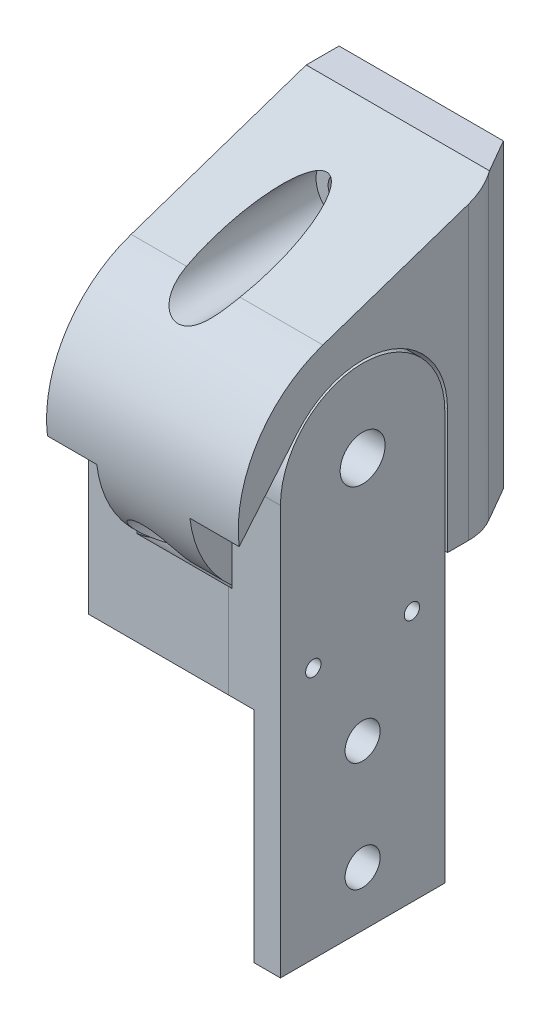
from build123d import *

# Parameters (mm, degrees)
SKETCH1_R               = 7.7
BOSS_EXTRUDE1_DEPTH     = 8.5
BOSS_EXTRUDE2_DEPTH     = 17.5
BOSS_EXTRUDE3_START     = 8.7
SKETCH1_5_R             = 7.7
SKETCH1_5_R_2           = 4.1
BOSS_EXTRUDE3_DEPTH     = 8.8
BOSS_EXTRUDE5_START     = 12.7
SKETCH1_8_W             = 40
SKETCH1_8_H             = 30
SKETCH1_8_R             = 3.2
BOSS_EXTRUDE5_DEPTH     = 4.8
BOSS_EXTRUDE6_START     = -17.5
BOSS_EXTRUDE6_DEPTH     = 30.2
BOSS_EXTRUDE7_START     = -17.5
SKETCH1_11_R            = 7.7
SKETCH1_11_R_2          = 4.1
BOSS_EXTRUDE7_DEPTH     = 8.8
SKETCH2_R               = 1.7
SKETCH2_R_2             = 1.4
CUT_EXTRUDE1_DEPTH      = 89.020338559
SKETCH2_4_R             = 3
SKETCH2_4_R_2           = 1.7
CUT_EXTRUDE2_DEPTH      = 4
SKETCH2_5_R             = 1.4
CUT_EXTRUDE3_DEPTH      = 89.020338559
SKETCH3_R               = 3.2
CUT_EXTRUDE4_DEPTH      = 76.747871257
CUT_EXTRUDE5_START      = -5
SKETCH3_3_R             = 6
SKETCH3_3_R_2           = 3.2
CUT_EXTRUDE5_DEPTH      = 71.747871257
CUT_EXTRUDE6_DEPTH      = 113.684249121
CUT_EXTRUDE7_DEPTH      = 94.476735073
CUT_EXTRUDE8_DEPTH      = 1
CUT_EXTRUDE8_DEPTH_BACK = 79.476735149
CUT_EXTRUDE8_START      = -15
CUT_EXTRUDE12_START     = -33
CUT_EXTRUDE12_DEPTH     = 61.476735149


with BuildPart() as part:
    # Sketch1 → Boss-Extrude1 (new, symmetric)
    with BuildSketch(Plane.YZ):
        with BuildLine():
            Line((-22.7, -15.5), (0, -15.5))
            ThreePointArc((0, -15.5), (14.565235622, -5.301312222), (9.96320795, 11.873688868))
            Line((9.96320795, 11.873688868), (-2.741125853, 22.533890677))
            ThreePointArc((-2.741125853, 22.533890677), (-16.992844919, 15.051020615), (-22.7, 0))
            Line((-22.7, 0), (-22.7, -15.5))
        make_face()
        with Locations(Location((0, 0, 0), (0, 0, 270))):
            Circle(SKETCH1_R, mode=Mode.SUBTRACT)
    extrude(amount=BOSS_EXTRUDE1_DEPTH, both=True)

    # Sketch1<3> → Boss-Extrude2 (add, symmetric)
    with BuildSketch(Plane.YZ):
        with BuildLine():
            Line((-16.584329953, -15.5), (-22.7, -15.5))
            Line((-22.7, -15.5), (-22.7, -30.7))
            Line((-22.7, -30.7), (32.3, -30.7))
            Line((32.3, -30.7), (32.3, -24.7))
            Line((32.3, -24.7), (21.506897801, 7.262461497))
            ThreePointArc((21.506897801, 7.262461497), (22.399738615, 3.679906244), (22.7, 0))
            ThreePointArc((22.7, 0), (8.331437753, -21.115803204), (-16.584329953, -15.5))
        make_face()
        with BuildLine():
            Line((0, -15.5), (-16.584329953, -15.5))
            ThreePointArc((-16.584329953, -15.5), (8.331437753, -21.115803204), (22.7, 0))
            ThreePointArc((22.7, 0), (22.399738615, 3.679906244), (21.506897801, 7.262461497))
            ThreePointArc((21.506897801, 7.262461497), (12.097218131, 19.208001289), (-2.741125853, 22.533890677))
            Line((-2.741125853, 22.533890677), (9.96320795, 11.873688868))
            ThreePointArc((9.96320795, 11.873688868), (14.565235622, -5.301312222), (0, -15.5))
        make_face()
    extrude(amount=BOSS_EXTRUDE2_DEPTH, both=True)

    # Sketch6 → Cut-Extrude6 (cut, through all)
    with BuildSketch(Plane(origin=(0, 32.3, 0), x_dir=(-1, 0, 0), z_dir=(0, 1, 0))):
        Polygon((-15.964101615, -24.7), (-17.5, -24.7), (-17.5, -30.7), (-12.5, -30.7), align=None)
        with BuildLine():
            ThreePointArc((-16.160254038, -24.360254038), (-17.159258263, -21.948444489), (-17.5, -19.360254038))
            Line((-17.5, -19.360254038), (-17.5, -24.7))
            Line((-17.5, -24.7), (-15.964101615, -24.7))
            Line((-15.964101615, -24.7), (-16.160254038, -24.360254038))
        make_face()
    extrude(amount=-CUT_EXTRUDE6_DEPTH, mode=Mode.SUBTRACT)

    # Sketch7 → Cut-Extrude7 (cut, through all)
    with BuildSketch(Plane(origin=(0, 0, -30.7), x_dir=(1, 0, 0), z_dir=(0, 0, -1))):
        with BuildLine():
            ThreePointArc((-2.5, 18.7), (-5.5, 15.7), (-2.5, 12.7))
            Line((-2.5, 12.7), (-2.5, 18.7))
        make_face()
        with BuildLine():
            Line((-2.5, 18.7), (-2.5, 12.7))
            ThreePointArc((-2.5, 12.7), (-0.378679656, 13.578679656), (0.5, 15.7))
            ThreePointArc((0.5, 15.7), (-0.378679656, 17.821320344), (-2.5, 18.7))
        make_face()
        with BuildLine():
            ThreePointArc((0.5, -23.3), (-0.378679656, -21.178679656), (-2.5, -20.3))
            Line((-2.5, -20.3), (-2.5, -26.3))
            ThreePointArc((-2.5, -26.3), (-0.378679656, -25.421320344), (0.5, -23.3))
        make_face()
        with BuildLine():
            Line((-2.5, -26.3), (-2.5, -20.3))
            ThreePointArc((-2.5, -20.3), (-5.5, -23.3), (-2.5, -26.3))
        make_face()
    extrude(amount=-CUT_EXTRUDE7_DEPTH, mode=Mode.SUBTRACT)

    # Sketch7<3> → Cut-Extrude8 (cut, two sides: drawn at the far end of the back side and taken through both)
    with BuildSketch(Plane(origin=(0, 0, -30.7), x_dir=(1, 0, 0), z_dir=(0, 0, -1)).offset(CUT_EXTRUDE8_START - CUT_EXTRUDE8_DEPTH_BACK)):
        with BuildLine():
            ThreePointArc((2.7, -23.3), (1.176955262, -19.623044738), (-2.5, -18.1))
            Line((-2.5, -18.1), (-2.5, -20.3))
            ThreePointArc((-2.5, -20.3), (-0.378679656, -21.178679656), (0.5, -23.3))
            ThreePointArc((0.5, -23.3), (-0.378679656, -25.421320344), (-2.5, -26.3))
            Line((-2.5, -26.3), (-2.5, -28.5))
            ThreePointArc((-2.5, -28.5), (1.176955262, -26.976955262), (2.7, -23.3))
        make_face()
        with BuildLine():
            Line((-2.5, -20.3), (-2.5, -18.1))
            ThreePointArc((-2.5, -18.1), (-7.7, -23.3), (-2.5, -28.5))
            Line((-2.5, -28.5), (-2.5, -26.3))
            ThreePointArc((-2.5, -26.3), (-5.5, -23.3), (-2.5, -20.3))
        make_face()
    extrude(amount=CUT_EXTRUDE8_DEPTH + CUT_EXTRUDE8_DEPTH_BACK, mode=Mode.SUBTRACT)

    # Sketch7<5> → Cut-Extrude12 (cut, through all)
    with BuildSketch(Plane(origin=(0, 0, -30.7), x_dir=(1, 0, 0), z_dir=(0, 0, -1)).offset(CUT_EXTRUDE12_START)):
        with BuildLine():
            ThreePointArc((-2.5, 20.9), (-7.7, 15.7), (-2.5, 10.5))
            Line((-2.5, 10.5), (-2.5, 12.7))
            ThreePointArc((-2.5, 12.7), (-5.5, 15.7), (-2.5, 18.7))
            Line((-2.5, 18.7), (-2.5, 20.9))
        make_face()
        with BuildLine():
            Line((-2.5, 12.7), (-2.5, 10.5))
            ThreePointArc((-2.5, 10.5), (1.176955262, 12.023044738), (2.7, 15.7))
            ThreePointArc((2.7, 15.7), (1.176955262, 19.376955262), (-2.5, 20.9))
            Line((-2.5, 20.9), (-2.5, 18.7))
            ThreePointArc((-2.5, 18.7), (-0.378679656, 17.821320344), (0.5, 15.7))
            ThreePointArc((0.5, 15.7), (-0.378679656, 13.578679656), (-2.5, 12.7))
        make_face()
    extrude(amount=-CUT_EXTRUDE12_DEPTH, mode=Mode.SUBTRACT)


with BuildPart() as body_2:
    # Sketch1<5> → Boss-Extrude3 (new body)
    # profile 1 of 6: a face of its own
    with BuildSketch(Plane.YZ.offset(BOSS_EXTRUDE3_START)):
        with BuildLine():
            ThreePointArc((-22.7, 0), (-21.237352775, -8.016535856), (-17.037898931, -15))
            Line((-17.037898932, -15), (0, -15))
            ThreePointArc((0, -15), (15, 0), (0, 15))
            Line((0, 15), (-17.037898932, 15))
            ThreePointArc((-17.037898932, 15), (-21.237352775, 8.016535856), (-22.7, 0))
        make_face()
        with Locations(Location((0, 0, 0), (0, 0, 270))):
            Circle(SKETCH1_5_R, mode=Mode.SUBTRACT)
    # profile 2 of 6: a face of its own
    with BuildSketch(Plane.YZ.offset(BOSS_EXTRUDE3_START)):
        with BuildLine():
            ThreePointArc((-23.077649337, 0), (-22.983043085, -2.08749359), (-22.7, -4.157871923))
            Line((-22.7, -4.157871923), (-22.7, 0))
            ThreePointArc((-22.7, 0), (-21.237352775, 8.016535856), (-17.037898932, 15))
            Line((-17.037898932, 15), (-17.537898931, 15))
            ThreePointArc((-17.537898931, 15), (-21.648456996, 7.995136562), (-23.077649337, 0))
        make_face()
    # profile 3 of 6: a face of its own
    with BuildSketch(Plane.YZ.offset(BOSS_EXTRUDE3_START)):
        with BuildLine():
            Line((-22.7, -4.157871923), (-22.7, -15))
            Line((-22.7, -15), (-17.537898931, -15))
            ThreePointArc((-17.537898931, -15), (-20.836507935, -9.920576395), (-22.7, -4.157871923))
        make_face()
    # profile 4 of 6: a face of its own
    with BuildSketch(Plane.YZ.offset(BOSS_EXTRUDE3_START)):
        with BuildLine():
            Line((-22.7, 0), (-22.7, -4.157871923))
            ThreePointArc((-22.7, -4.157871923), (-20.836507935, -9.920576395), (-17.537898931, -15))
            Line((-17.537898931, -15), (-17.037898932, -15))
            ThreePointArc((-17.037898931, -15), (-21.237352775, -8.016535856), (-22.7, 0))
        make_face()
    # profile 5 of 6: a face of its own
    with BuildSketch(Plane.YZ.offset(BOSS_EXTRUDE3_START)):
        with BuildLine():
            Line((-23.077649337, -15), (-22.7, -15))
            Line((-22.7, -15), (-22.7, -4.157871923))
            ThreePointArc((-22.7, -4.157871923), (-22.983043085, -2.08749359), (-23.077649337, 0))
            Line((-23.077649337, 0), (-23.077649337, -15))
        make_face()
    # profile 6 of 6: a face of its own
    with BuildSketch(Plane.YZ.offset(BOSS_EXTRUDE3_START)):
        with Locations(Location((0, 0, 0), (0, 0, 270))):
            Circle(SKETCH1_5_R)
        with Locations(Location((0, 0, 0), (0, 0, 270))):
            Circle(SKETCH1_5_R_2, mode=Mode.SUBTRACT)
    extrude(amount=BOSS_EXTRUDE3_DEPTH)

    # Sketch1<8> → Boss-Extrude5 (add)
    # profile 1 of 2: a face of its own
    with BuildSketch(Plane.YZ.offset(BOSS_EXTRUDE5_START)):
        with Locations((-54.7, 0)):
            Rectangle(SKETCH1_8_W, SKETCH1_8_H)
        with Locations(Location((-64.7, 0, 0), (0, 0, 90))):
            Circle(SKETCH1_8_R, mode=Mode.SUBTRACT)
        with Locations(Location((-44.7, 0, 0), (0, 0, 90))):
            Circle(SKETCH1_8_R, mode=Mode.SUBTRACT)
    # profile 2 of 2: a face of its own
    with BuildSketch(Plane.YZ.offset(BOSS_EXTRUDE5_START)):
        with BuildLine():
            Line((-34.7, -15), (-23.077649337, -15))
            Line((-23.077649337, -15), (-23.077649337, 0))
            ThreePointArc((-23.077649337, 0), (-21.648456996, 7.995136562), (-17.537898931, 15))
            Line((-17.537898931, 15), (-34.7, 15))
            Line((-34.7, 15), (-34.7, -15))
        make_face()
    extrude(amount=BOSS_EXTRUDE5_DEPTH)

    # Sketch1<9> → Boss-Extrude6 (add)
    with BuildSketch(Plane.YZ.offset(BOSS_EXTRUDE6_START)):
        with BuildLine():
            Line((-34.7, -15), (-23.077649337, -15))
            Line((-23.077649337, -15), (-23.077649337, 0))
            ThreePointArc((-23.077649337, 0), (-21.648456996, 7.995136562), (-17.537898931, 15))
            Line((-17.537898931, 15), (-34.7, 15))
            Line((-34.7, 15), (-34.7, -15))
        make_face()
    extrude(amount=BOSS_EXTRUDE6_DEPTH)

    # Sketch1<11> → Boss-Extrude7 (add)
    # profile 1 of 6: a face of its own
    with BuildSketch(Plane.YZ.offset(BOSS_EXTRUDE7_START)):
        with BuildLine():
            ThreePointArc((-22.7, 0), (-21.237352775, -8.016535856), (-17.037898931, -15))
            Line((-17.037898932, -15), (0, -15))
            ThreePointArc((0, -15), (15, 0), (0, 15))
            Line((0, 15), (-17.037898932, 15))
            ThreePointArc((-17.037898932, 15), (-21.237352775, 8.016535856), (-22.7, 0))
        make_face()
        with Locations(Location((0, 0, 0), (0, 0, 270))):
            Circle(SKETCH1_11_R, mode=Mode.SUBTRACT)
    # profile 2 of 6: a face of its own
    with BuildSketch(Plane.YZ.offset(BOSS_EXTRUDE7_START)):
        with BuildLine():
            Line((-22.7, -4.157871923), (-22.7, -15))
            Line((-22.7, -15), (-17.537898931, -15))
            ThreePointArc((-17.537898931, -15), (-20.836507935, -9.920576395), (-22.7, -4.157871923))
        make_face()
    # profile 3 of 6: a face of its own
    with BuildSketch(Plane.YZ.offset(BOSS_EXTRUDE7_START)):
        with BuildLine():
            Line((-22.7, 0), (-22.7, -4.157871923))
            ThreePointArc((-22.7, -4.157871923), (-20.836507935, -9.920576395), (-17.537898931, -15))
            Line((-17.537898931, -15), (-17.037898932, -15))
            ThreePointArc((-17.037898931, -15), (-21.237352775, -8.016535856), (-22.7, 0))
        make_face()
    # profile 4 of 6: a face of its own
    with BuildSketch(Plane.YZ.offset(BOSS_EXTRUDE7_START)):
        with BuildLine():
            Line((-23.077649337, -15), (-22.7, -15))
            Line((-22.7, -15), (-22.7, -4.157871923))
            ThreePointArc((-22.7, -4.157871923), (-22.983043085, -2.08749359), (-23.077649337, 0))
            Line((-23.077649337, 0), (-23.077649337, -15))
        make_face()
    # profile 5 of 6: a face of its own
    with BuildSketch(Plane.YZ.offset(BOSS_EXTRUDE7_START)):
        with BuildLine():
            ThreePointArc((-23.077649337, 0), (-22.983043085, -2.08749359), (-22.7, -4.157871923))
            Line((-22.7, -4.157871923), (-22.7, 0))
            ThreePointArc((-22.7, 0), (-21.237352775, 8.016535856), (-17.037898932, 15))
            Line((-17.037898932, 15), (-17.537898931, 15))
            ThreePointArc((-17.537898931, 15), (-21.648456996, 7.995136562), (-23.077649337, 0))
        make_face()
    # profile 6 of 6: a face of its own
    with BuildSketch(Plane.YZ.offset(BOSS_EXTRUDE7_START)):
        with Locations(Location((0, 0, 0), (0, 0, 270))):
            Circle(SKETCH1_11_R)
        with Locations(Location((0, 0, 0), (0, 0, 270))):
            Circle(SKETCH1_11_R_2, mode=Mode.SUBTRACT)
    extrude(amount=BOSS_EXTRUDE7_DEPTH)


with BuildPart() as body_3:
    # Split1: the piece on the far side of the plane
    add(body_2.part)
    split(bisect_by=Plane(origin=(8, 0, 0), x_dir=(0, 0, 1), z_dir=(1, 0, 0)), keep=Keep.BOTTOM)

    # Sketch2 → Cut-Extrude1 (cut, through all)
    with BuildSketch(Plane(origin=(-17.5, 0, 0), x_dir=(0, -1, 0), z_dir=(-1, 0, 0))):
        with Locations(Location((28.7, 9, 0), (0, 0, 90))):
            Circle(SKETCH2_R)
        with Locations(Location((28.7, -9, 0), (0, 0, 90))):
            Circle(SKETCH2_R)
        with Locations((28.7, 9)):
            Circle(SKETCH2_R_2)
        with Locations((28.7, -9)):
            Circle(SKETCH2_R_2)
    extrude(amount=-CUT_EXTRUDE1_DEPTH, mode=Mode.SUBTRACT)

    # Sketch2<4> → Cut-Extrude2 (cut)
    # profile 1 of 2: a face of its own
    with BuildSketch(Plane(origin=(-17.5, 0, 0), x_dir=(0, -1, 0), z_dir=(-1, 0, 0))):
        with Locations(Location((28.7, 9, 0), (0, 0, 90))):
            Circle(SKETCH2_4_R)
        with Locations(Location((28.7, 9, 0), (0, 0, 90))):
            Circle(SKETCH2_4_R_2, mode=Mode.SUBTRACT)
    # profile 2 of 2: a face of its own
    with BuildSketch(Plane(origin=(-17.5, 0, 0), x_dir=(0, -1, 0), z_dir=(-1, 0, 0))):
        with Locations(Location((28.7, -9, 0), (0, 0, 90))):
            Circle(SKETCH2_4_R)
        with Locations(Location((28.7, -9, 0), (0, 0, 90))):
            Circle(SKETCH2_4_R_2, mode=Mode.SUBTRACT)
    extrude(amount=-CUT_EXTRUDE2_DEPTH, mode=Mode.SUBTRACT)

    # Sketch3 → Cut-Extrude4 (cut, through all)
    with BuildSketch(Plane.XZ.offset(34.7)):
        with Locations(Location((-2.5, 0, 0), (0, 0, 270))):
            Circle(SKETCH3_R)
    extrude(amount=-CUT_EXTRUDE4_DEPTH, mode=Mode.SUBTRACT)

    # Sketch3<3> → Cut-Extrude5 (cut, through all)
    with BuildSketch(Plane.XZ.offset(34.7).offset(CUT_EXTRUDE5_START)):
        with Locations(Location((-2.5, 0, 0), (0, 0, 270))):
            Circle(SKETCH3_3_R)
        with Locations(Location((-2.5, 0, 0), (0, 0, 270))):
            Circle(SKETCH3_3_R_2, mode=Mode.SUBTRACT)
    extrude(amount=-CUT_EXTRUDE5_DEPTH, mode=Mode.SUBTRACT)


with BuildPart() as body_2_1:
    add(body_2.part)

    # Split1
    split(bisect_by=Plane(origin=(8, 0, 0), x_dir=(0, 0, 1), z_dir=(1, 0, 0)), keep=Keep.TOP)

    # Sketch2<5> → Cut-Extrude3 (cut, through all)
    with BuildSketch(Plane(origin=(-17.5, 0, 0), x_dir=(0, -1, 0), z_dir=(-1, 0, 0))):
        with Locations(Location((28.7, 9, 0), (0, 0, 90))):
            Circle(SKETCH2_5_R)
        with Locations(Location((28.7, -9, 0), (0, 0, 90))):
            Circle(SKETCH2_5_R)
    extrude(amount=-CUT_EXTRUDE3_DEPTH, mode=Mode.SUBTRACT)


solid = Compound([part.part, body_3.part, body_2_1.part])
